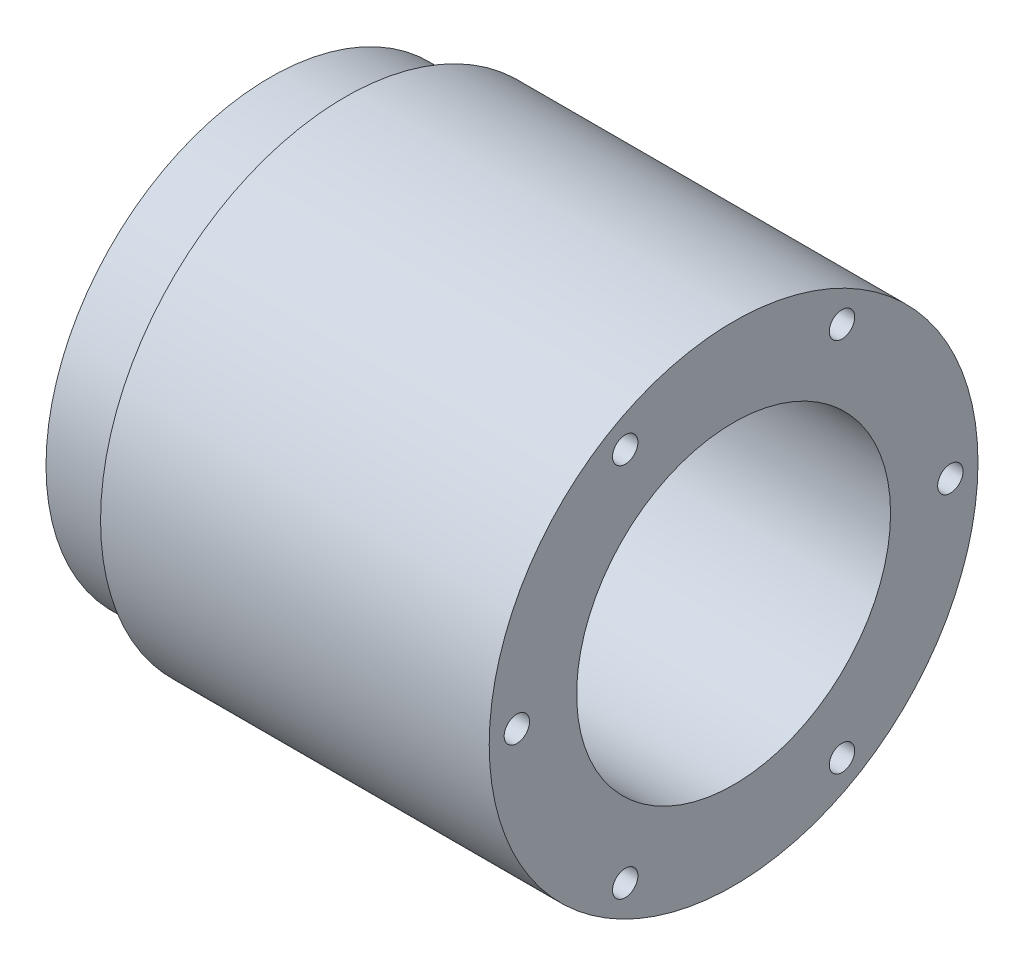
from build123d import *

# Parameters (mm, degrees)
CROQUIS1_R                       = 32.7
CROQUIS1_R_2                     = 21
SALIENTE_EXTRUIR1_DEPTH          = 23.5
CROQUIS3_R                       = 32.7
SALIENTE_EXTRUIR3_DEPTH          = 5
CROQUIS4_R                       = 3.5
CORTAR_EXTRUIR1_DEPTH            = 6
CROQUIS21_R                      = 30
SALIENTE_EXTRUIR4_DEPTH          = 10
TALADRO_DE_MARGEN_PARA_M31_D     = 3.4
TALADRO_DE_MARGEN_PARA_M31_DEPTH = 10
TALADRO_DE_MARGEN_PARA_M31_TIP   = 1.021463052


with BuildPart() as part:
    # Croquis1 → Saliente-Extruir1 (new, symmetric)
    with BuildSketch(Plane(origin=(0, 0, 0), x_dir=(0, 0, -1), z_dir=(1, 0, 0))):
        Circle(CROQUIS1_R)
        Circle(CROQUIS1_R_2, mode=Mode.SUBTRACT)
    extrude(amount=SALIENTE_EXTRUIR1_DEPTH, both=True)

    # Croquis3 → Saliente-Extruir3 (add)
    with BuildSketch(Plane.ZY.offset(23.5)):
        Circle(CROQUIS3_R)
        with BuildLine():
            Line((-18, 21), (18, 21))
            ThreePointArc((18, 21), (20.121320344, 20.121320344), (21, 18))
            Line((21, 18), (21, -18))
            ThreePointArc((21, -18), (20.121320344, -20.121320344), (18, -21))
            Line((18, -21), (-18, -21))
            ThreePointArc((-18, -21), (-20.121320344, -20.121320344), (-21, -18))
            Line((-21, -18), (-21, 18))
            ThreePointArc((-21, 18), (-20.121320344, 20.121320344), (-18, 21))
        make_face(mode=Mode.SUBTRACT)
    extrude(amount=SALIENTE_EXTRUIR3_DEPTH)

    # Croquis4 → Cortar-Extruir1 (cut)
    with BuildSketch(Plane.ZY.offset(23.5)):
        with Locations((15.5, 15.5)):
            Circle(CROQUIS4_R)
        with Locations((-15.5, 15.5)):
            Circle(CROQUIS4_R)
        with Locations((-15.5, -15.5)):
            Circle(CROQUIS4_R)
        with Locations((15.5, -15.5)):
            Circle(CROQUIS4_R)
    extrude(amount=-CORTAR_EXTRUIR1_DEPTH, mode=Mode.SUBTRACT)

    # Croquis21 → Saliente-Extruir4 (add)
    with BuildSketch(Plane.ZY.offset(28.5)):
        Circle(CROQUIS21_R)
        with BuildLine():
            Line((18, 21), (0, 21))
            Line((0, 21), (-18, 21))
            ThreePointArc((-18, 21), (-20.121320344, 20.121320344), (-21, 18))
            Line((-21, 18), (-21, 0))
            Line((-21, 0), (-21, -18))
            ThreePointArc((-21, -18), (-20.121320344, -20.121320344), (-18, -21))
            Line((-18, -21), (0, -21))
            Line((0, -21), (18, -21))
            ThreePointArc((18, -21), (20.121320344, -20.121320344), (21, -18))
            Line((21, -18), (21, 0))
            Line((21, 0), (21, 18))
            ThreePointArc((21, 18), (20.121320344, 20.121320344), (18, 21))
        make_face(mode=Mode.SUBTRACT)
    extrude(amount=SALIENTE_EXTRUIR4_DEPTH)

    # Taladro de margen para M31
    with Locations(Plane(origin=(23.5, 0, 0), x_dir=(0, 0, -1), z_dir=(1, 0, 0))):
        with Locations((29, 0), (14.5, -25.11473671), (-14.5, -25.11473671), (-29, 0), (-14.5, 25.11473671), (14.5, 25.11473671)):
            Hole(TALADRO_DE_MARGEN_PARA_M31_D / 2, depth=TALADRO_DE_MARGEN_PARA_M31_DEPTH)
            with Locations((0, 0, -(TALADRO_DE_MARGEN_PARA_M31_DEPTH + TALADRO_DE_MARGEN_PARA_M31_TIP / 2))):  # 118° drill point
                Cone(0, TALADRO_DE_MARGEN_PARA_M31_D / 2, TALADRO_DE_MARGEN_PARA_M31_TIP, mode=Mode.SUBTRACT)


solid = part.part
